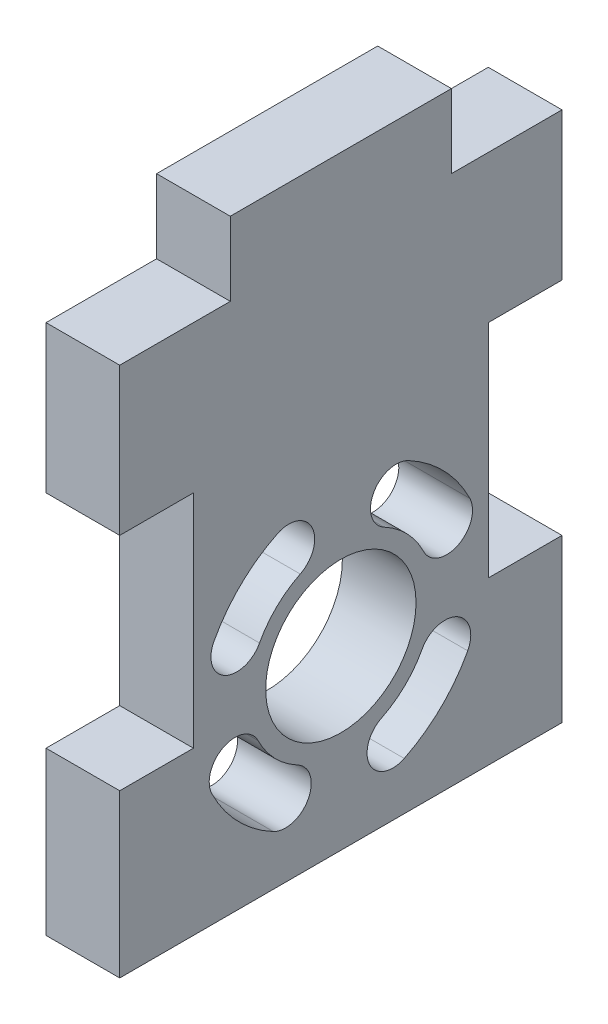
from build123d import *

# Parameters (mm, degrees)
SKETCH_1_R      = 5.1
EXTRUDE_1_DEPTH = 5


with BuildPart() as part:
    # 草图1 → 凸台-拉伸1 (new body)
    with BuildSketch(Plane(origin=(0, 0, 0), x_dir=(0, 0, -1), z_dir=(1, 0, 0))):
        Polygon((-22.5, 36), (-30, 36), (-30, 26), (-25, 26), (-25, 11), (-30, 11), (-30, 0), (0, 0), (0, 11), (-5, 11), (-5, 26), (0, 26), (0, 36), (-7.5, 36), (-7.5, 41), (-22.5, 41), align=None)
        with Locations((-15, 12)):
            Circle(SKETCH_1_R, mode=Mode.SUBTRACT)
        with BuildLine():
            ThreePointArc((-19.298590679, 20.751263804), (-21.780876657, 19.005869808), (-23.606339093, 16.58185851))
            ThreePointArc((-23.606339093, 16.58185851), (-22.883996425, 14.21474612), (-20.516884034, 14.937088789))
            ThreePointArc((-20.516884034, 14.937088789), (-19.346715806, 16.490942184), (-17.755506846, 17.60978449))
            ThreePointArc((-17.755506846, 17.60978449), (-16.956309105, 19.952066064), (-19.298590679, 20.751263804))
        make_face(mode=Mode.SUBTRACT)
        with BuildLine():
            ThreePointArc((-6.248736196, 16.298590679), (-7.994130192, 18.780876657), (-10.41814149, 20.606339093))
            ThreePointArc((-10.41814149, 20.606339093), (-12.78525388, 19.883996425), (-12.062911211, 17.516884034))
            ThreePointArc((-12.062911211, 17.516884034), (-10.509057816, 16.346715806), (-9.39021551, 14.755506846))
            ThreePointArc((-9.39021551, 14.755506846), (-7.047933936, 13.956309105), (-6.248736196, 16.298590679))
        make_face(mode=Mode.SUBTRACT)
        with BuildLine():
            ThreePointArc((-10.701409321, 3.248736196), (-8.219123343, 4.994130192), (-6.393660907, 7.41814149))
            ThreePointArc((-6.393660907, 7.41814149), (-7.116003575, 9.78525388), (-9.483115966, 9.062911211))
            ThreePointArc((-9.483115966, 9.062911211), (-10.653284194, 7.509057816), (-12.244493154, 6.39021551))
            ThreePointArc((-12.244493154, 6.39021551), (-13.043690895, 4.047933936), (-10.701409321, 3.248736196))
        make_face(mode=Mode.SUBTRACT)
        with BuildLine():
            ThreePointArc((-23.751263804, 7.701409321), (-22.005869808, 5.219123343), (-19.58185851, 3.393660907))
            ThreePointArc((-19.58185851, 3.393660907), (-17.21474612, 4.116003575), (-17.937088789, 6.483115966))
            ThreePointArc((-17.937088789, 6.483115966), (-19.490942184, 7.653284194), (-20.60978449, 9.244493154))
            ThreePointArc((-20.60978449, 9.244493154), (-22.952066064, 10.043690895), (-23.751263804, 7.701409321))
        make_face(mode=Mode.SUBTRACT)
    extrude(amount=EXTRUDE_1_DEPTH)


solid = part.part
